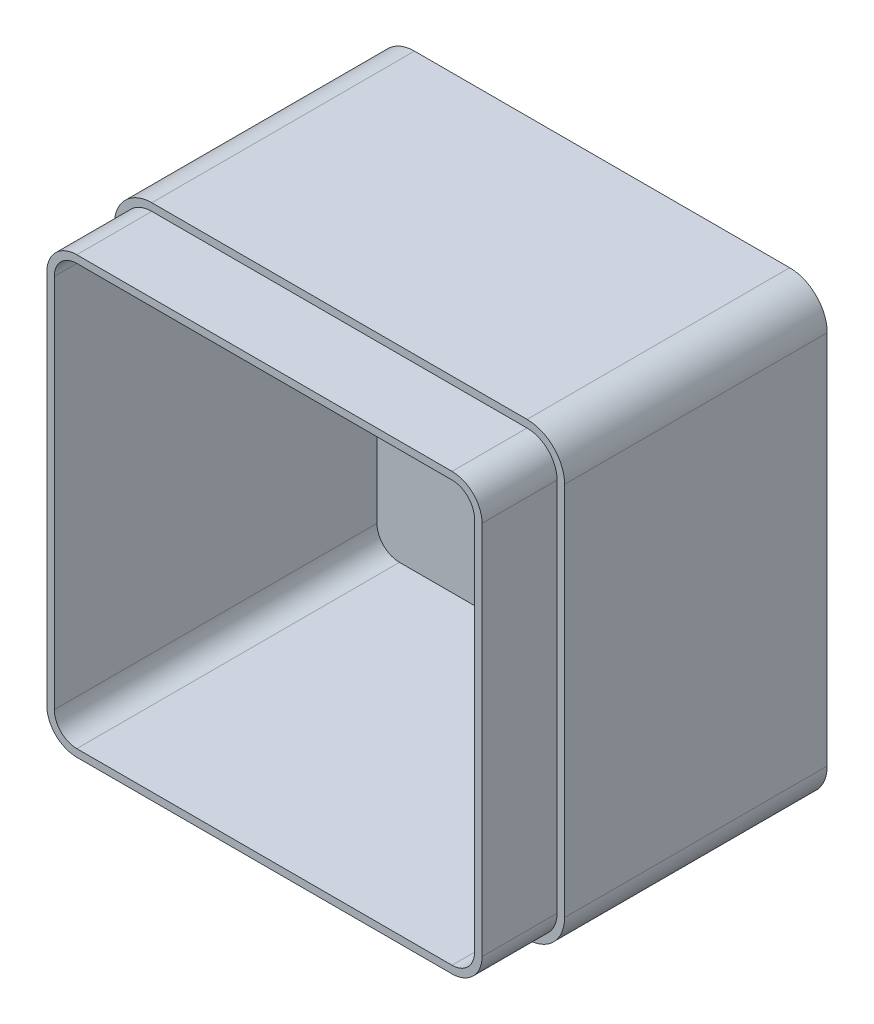
from build123d import *

# Parameters (mm, degrees)
SKETCH1_W           = 120
SKETCH1_H           = 120
BOSS_EXTRUDE1_DEPTH = 90
FILLET1_R           = 10
SHELL1_T            = -4
CUT_EXTRUDE2_DEPTH  = 20


with BuildPart() as part:
    # Sketch1 → Boss-Extrude1 (new body)
    with BuildSketch(Plane.XY):
        with Locations((-60, 60)):
            Rectangle(SKETCH1_W, SKETCH1_H)
    extrude(amount=BOSS_EXTRUDE1_DEPTH)

    # Fillet1
    fillet1_edges = [part.edges().sort_by_distance(p)[0] for p in [
        (0, 0, 45),
        (-120, 0, 45),
        (-120, 120, 45),
        (0, 120, 45),
    ]]
    fillet(fillet1_edges, radius=FILLET1_R)

    # Shell1
    shell1_openings = [part.faces().sort_by_distance(p)[0] for p in [
        (-60, 60, 90),
    ]]
    offset(amount=SHELL1_T, openings=shell1_openings, kind=Kind.INTERSECTION)

    # Sketch4 → Cut-Extrude2 (cut)
    with BuildSketch(Plane.XY.offset(90)):
        with BuildLine():
            Line((-120, 110), (-120, 10))
            ThreePointArc((-120, 10), (-117.071067812, 2.928932188), (-110, 0))
            Line((-110, 0), (-10, 0))
            ThreePointArc((-10, 0), (-2.928932188, 2.928932188), (0, 10))
            Line((0, 10), (0, 110))
            ThreePointArc((0, 110), (-2.928932188, 117.071067812), (-10, 120))
            Line((-10, 120), (-110, 120))
            ThreePointArc((-110, 120), (-117.071067812, 117.071067812), (-120, 110))
        make_face()
        with BuildLine():
            Line((-118, 110), (-118, 10))
            ThreePointArc((-118, 10), (-115.656854249, 4.343145751), (-110, 2))
            Line((-110, 2), (-10, 2))
            ThreePointArc((-10, 2), (-4.343145751, 4.343145751), (-2, 10))
            Line((-2, 10), (-2, 110))
            ThreePointArc((-2, 110), (-4.343145751, 115.656854249), (-10, 118))
            Line((-10, 118), (-110, 118))
            ThreePointArc((-110, 118), (-115.656854249, 115.656854249), (-118, 110))
        make_face(mode=Mode.SUBTRACT)
    extrude(amount=-CUT_EXTRUDE2_DEPTH, mode=Mode.SUBTRACT)


solid = part.part
